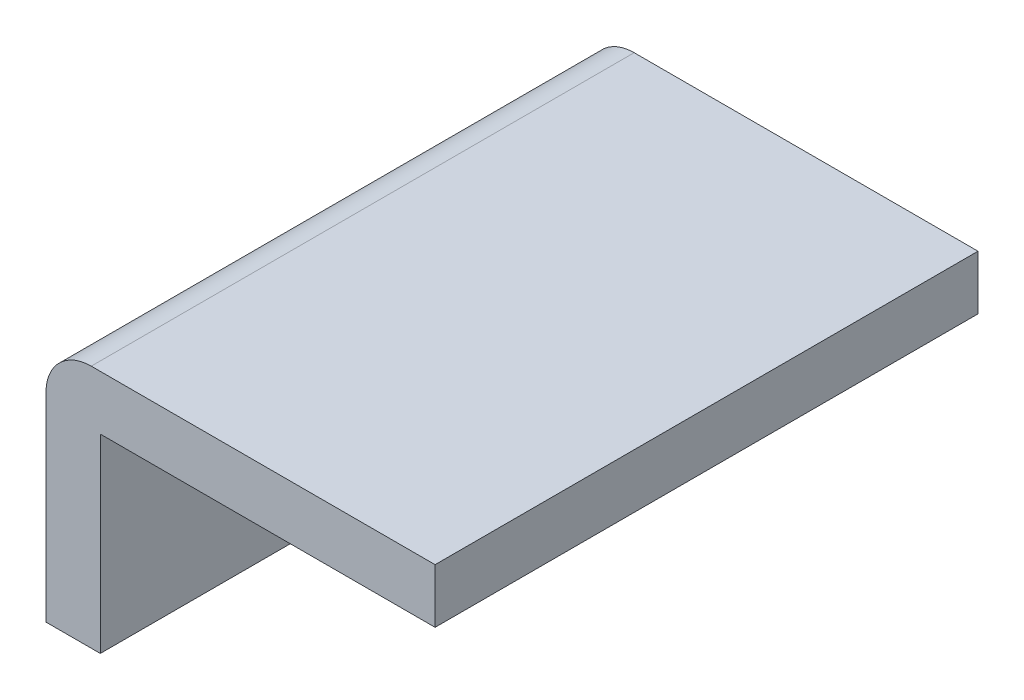
from build123d import *

# Parameters (mm, degrees)
BOSS_EXTRUDE1_DEPTH = 30


with BuildPart() as part:
    # Sketch1 → Boss-Extrude1 (new body)
    with BuildSketch(Plane.XY):
        with BuildLine():
            Line((0, 11), (0, 0))
            Line((0, 0), (1.5, 0))
            Line((1.5, 0), (1.5, 10.5))
            Line((1.5, 10.5), (20, 10.5))
            Line((20, 10.5), (20, 12))
            Line((20, 12), (1, 12))
            ThreePointArc((1, 12), (0.292893219, 11.707106781), (0, 11))
        make_face()
        with BuildLine():
            Line((-1.5, 0), (0, 0))
            Line((0, 0), (0, 11))
            ThreePointArc((0, 11), (0.292893219, 11.707106781), (1, 12))
            Line((1, 12), (20, 12))
            Line((20, 12), (20, 13.5))
            Line((20, 13.5), (1, 13.5))
            ThreePointArc((1, 13.5), (-0.767766953, 12.767766953), (-1.5, 11))
            Line((-1.5, 11), (-1.5, 0))
        make_face()
    extrude(amount=BOSS_EXTRUDE1_DEPTH)


solid = part.part
